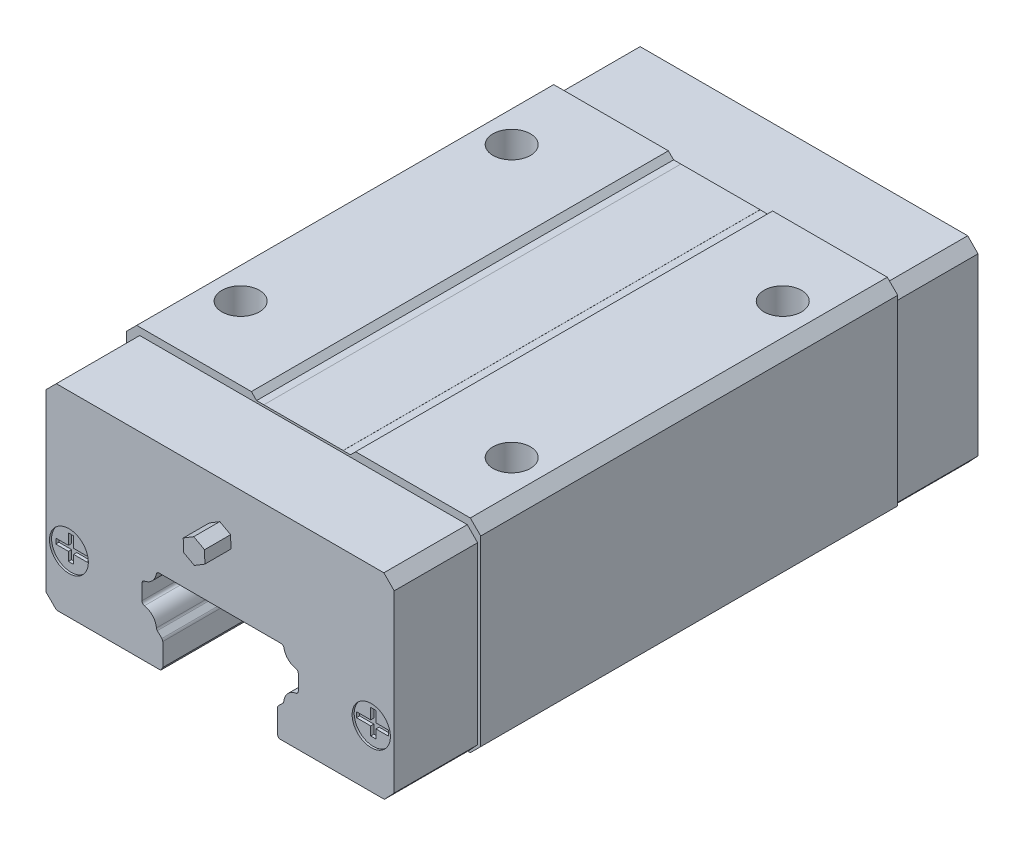
from build123d import *

# Parameters (mm, degrees)
SKETCH_1_R          = 0.735969578
EXTRUDE_1_DEPTH     = 40
SKETCH_2_R          = 0.735969578
EXTRUDE_2_DEPTH     = 8
SKETCH_3_R          = 1.863573056
SKETCH_3_R_2        = 1.835239234
CUT_EXTRUDE_3_DEPTH = 0.2
CUT_EXTRUDE_6_DEPTH = 0.5
EXTRUDE_7_DEPTH     = 2.5
SKETCH_6_R          = 1.8
CUT_EXTRUDE_8_DEPTH = 10


with BuildPart() as part:
    # 草图1 → 拉伸1 (new body)
    with BuildSketch(Plane.XY):
        with BuildLine():
            Line((1190.283750121, 451.89461201), (1190.783750121, 451.39461201))
            Line((1190.783750121, 451.39461201), (1191.483750121, 451.39461201))
            Line((1191.483750121, 451.39461201), (1199.081809381, 451.402434026))
            Line((1199.081809381, 451.402434026), (1199.083750121, 451.39461201))
            Line((1199.083750121, 451.39461201), (1199.783750121, 451.39461201))
            Line((1199.783750121, 451.39461201), (1200.283750121, 451.89461201))
            Line((1200.283750121, 451.89461201), (1211.283750121, 451.89461201))
            Line((1211.283750121, 451.89461201), (1212.283750121, 450.89461201))
            Line((1212.283750121, 450.89461201), (1212.283750121, 433.39461201))
            Line((1212.283750121, 433.39461201), (1211.283750121, 432.39461201))
            Line((1211.283750121, 432.39461201), (1200.983749521, 432.39461201))
            Line((1200.983749521, 432.39461201), (1200.871618065, 432.506743541))
            ThreePointArc((1200.871618065, 432.506743541), (1200.80658624, 432.604070545), (1200.783750099, 432.718875575))
            Line((1200.783750099, 432.718875575), (1200.783750099, 434.876567528))
            ThreePointArc((1200.783750099, 434.876567528), (1200.806586127, 434.991372287), (1200.87161765, 435.088699147))
            Line((1200.87161765, 435.088699147), (1201.302904227, 435.519987412))
            ThreePointArc((1201.302904227, 435.519987412), (1201.362083129, 435.604095006), (1201.389379239, 435.703247172))
            ThreePointArc((1201.389379239, 435.703247172), (1201.754733531, 436.527663779), (1202.540800569, 436.969529272))
            ThreePointArc((1202.540800569, 436.969529272), (1202.71512489, 437.073094794), (1202.783750031, 437.263896724))
            Line((1202.783750031, 437.263896724), (1202.783750031, 438.725177348))
            ThreePointArc((1202.783750031, 438.725177348), (1202.715175139, 438.916076324), (1202.540800569, 439.01970279))
            ThreePointArc((1202.540800569, 439.01970279), (1201.801578733, 439.4124447), (1201.408836823, 440.151666536))
            ThreePointArc((1201.408836823, 440.151666536), (1201.305210357, 440.326041106), (1201.114311381, 440.394615998))
            Line((1201.114311381, 440.394615998), (1189.453188747, 440.394615998))
            ThreePointArc((1189.453188747, 440.394615998), (1189.26228977, 440.326041106), (1189.158663305, 440.151666536))
            ThreePointArc((1189.158663305, 440.151666536), (1188.765921394, 439.412444701), (1188.026699559, 439.01970279))
            ThreePointArc((1188.026699559, 439.01970279), (1187.852375251, 438.916137249), (1187.783750121, 438.725335317))
            Line((1187.783750121, 438.725335317), (1187.783750121, 437.264054693))
            ThreePointArc((1187.783750121, 437.264054693), (1187.852325013, 437.073155717), (1188.026699583, 436.969529251))
            ThreePointArc((1188.026699583, 436.969529251), (1188.812766668, 436.527663733), (1189.178120982, 435.703247076))
            ThreePointArc((1189.178120982, 435.703247076), (1189.205417093, 435.60409491), (1189.264595994, 435.519987316))
            Line((1189.264595994, 435.519987316), (1189.695882571, 435.088699051))
            ThreePointArc((1189.695882571, 435.088699051), (1189.760914094, 434.991372191), (1189.783750121, 434.876567432))
            Line((1189.783750121, 434.876567432), (1189.783750121, 432.718875479))
            ThreePointArc((1189.783750121, 432.718875479), (1189.760913981, 432.604070449), (1189.695882156, 432.506743445))
            Line((1189.695882156, 432.506743445), (1189.583750721, 432.39461201))
            Line((1189.583750721, 432.39461201), (1179.583750121, 432.39461201))
            Line((1179.583750121, 432.39461201), (1178.583750121, 433.39461201))
            Line((1178.583750121, 433.39461201), (1178.583750121, 445.59461201))
            Line((1178.583750121, 445.59461201), (1178.283750121, 445.89461201))
            Line((1178.283750121, 445.89461201), (1178.283750121, 450.89461201))
            Line((1178.283750121, 450.89461201), (1179.283750121, 451.89461201))
            Line((1179.283750121, 451.89461201), (1190.283750121, 451.89461201))
        make_face()
        with Locations((1195.283750121, 446.39461201)):
            Circle(SKETCH_1_R, mode=Mode.SUBTRACT)
    extrude(amount=EXTRUDE_1_DEPTH)

    # 草图2 → 拉伸2 (add)
    with BuildSketch(Plane.XY.offset(40)):
        with BuildLine():
            Line((1211.041388892, 432.39461201), (1200.983749521, 432.39461201))
            ThreePointArc((1200.983749521, 432.39461201), (1200.8413936, 432.530619311), (1200.783750099, 432.718875575))
            Line((1200.783750099, 432.718875575), (1200.783750099, 434.876567528))
            ThreePointArc((1200.783750099, 434.876567528), (1200.806586127, 434.991372287), (1200.87161765, 435.088699147))
            Line((1200.87161765, 435.088699147), (1201.302904227, 435.519987412))
            ThreePointArc((1201.302904227, 435.519987412), (1201.362107996, 435.604083272), (1201.389379239, 435.703247172))
            ThreePointArc((1201.389379239, 435.703247172), (1201.754548351, 436.527832162), (1202.540800569, 436.969529272))
            ThreePointArc((1202.540800569, 436.969529272), (1202.715168649, 437.073058679), (1202.783750031, 437.263896724))
            Line((1202.783750031, 437.263896724), (1202.783750031, 438.725177348))
            ThreePointArc((1202.783750031, 438.725177348), (1202.715175139, 438.916076324), (1202.540800569, 439.01970279))
            ThreePointArc((1202.540800569, 439.01970279), (1201.801578746, 439.412444713), (1201.408836823, 440.151666536))
            ThreePointArc((1201.408836823, 440.151666536), (1201.305210357, 440.326041106), (1201.114311381, 440.394615998))
            Line((1201.114311381, 440.394615998), (1189.453188747, 440.394615998))
            ThreePointArc((1189.453188747, 440.394615998), (1189.26228977, 440.326041106), (1189.158663305, 440.151666536))
            ThreePointArc((1189.158663305, 440.151666536), (1188.765921381, 439.412444713), (1188.026699559, 439.01970279))
            ThreePointArc((1188.026699559, 439.01970279), (1187.852375251, 438.916137249), (1187.783750121, 438.725335317))
            Line((1187.783750121, 438.725335317), (1187.783750121, 437.264054693))
            ThreePointArc((1187.783750121, 437.264054693), (1187.852325013, 437.073155717), (1188.026699583, 436.969529251))
            ThreePointArc((1188.026699583, 436.969529251), (1188.812766654, 436.52766372), (1189.178120982, 435.703247076))
            ThreePointArc((1189.178120982, 435.703247076), (1189.205417092, 435.60409491), (1189.264595994, 435.519987316))
            Line((1189.264595994, 435.519987316), (1189.695882571, 435.088699051))
            ThreePointArc((1189.695882571, 435.088699051), (1189.760914094, 434.991372191), (1189.783750121, 434.876567432))
            Line((1189.783750121, 434.876567432), (1189.783750121, 432.718875479))
            Line((1189.783750121, 432.718875479), (1189.583750721, 432.39461201))
            Line((1189.583750721, 432.39461201), (1179.583750121, 432.39461201))
            Line((1179.583750121, 432.39461201), (1178.583750121, 433.39461201))
            Line((1178.583750121, 433.39461201), (1178.583750121, 450.204662517))
            Line((1178.583750121, 450.204662517), (1179.573699615, 451.19461201))
            Line((1179.573699615, 451.19461201), (1210.993800628, 451.19461201))
            Line((1210.993800628, 451.19461201), (1211.983750121, 450.188667467))
            Line((1211.983750121, 450.188667467), (1211.983750121, 433.39461201))
            Line((1211.983750121, 433.39461201), (1211.041388892, 432.39461201))
        make_face()
        with Locations((1195.283750121, 446.39461201)):
            Circle(SKETCH_2_R, mode=Mode.SUBTRACT)
    extrude_2 = extrude(amount=EXTRUDE_2_DEPTH)

    # 镜向2: 拉伸2 across plane
    add(extrude_2.mirror(Plane(origin=(0, 0, 20), x_dir=(1, 0, 0), z_dir=(0, 0, -1))))

    # 草图3 → 拉伸3 (cut)
    with BuildSketch(Plane.XY.offset(48)):
        with Locations((1180.782779751, 437.89461201)):
            Circle(SKETCH_3_R)
        with Locations((1209.782779751, 437.89461201)):
            Circle(SKETCH_3_R_2)
    cut_extrude_3 = extrude(amount=-CUT_EXTRUDE_3_DEPTH, mode=Mode.SUBTRACT)

    # 草图3<4> → 拉伸6 (cut)
    with BuildSketch(Plane.XY.offset(48)):
        Polygon((1209.532779751, 437.64461201), (1209.532779751, 436.80811406), (1210.032779751, 436.80811406), (1210.032779751, 436.829157907), (1210.032779751, 437.64461201), (1211.245181043, 437.64461201), (1211.245181043, 438.14461201), (1210.032779751, 438.14461201), (1210.032779751, 439.179594206), (1209.532779751, 439.179594206), (1209.532779751, 438.14461201), (1208.172931448, 438.14461201), (1208.172931448, 437.64461201), align=None)
        Polygon((1179.320378459, 438.14461201), (1180.532779751, 438.14461201), (1180.532779751, 439.179594206), (1181.032779751, 439.179594206), (1181.032779751, 438.14461201), (1182.392628054, 438.14461201), (1182.392628054, 437.64461201), (1181.032779751, 437.64461201), (1181.032779751, 436.80811406), (1180.532779751, 436.80811406), (1180.532779751, 437.64461201), (1179.320378459, 437.64461201), align=None)
    cut_extrude_6 = extrude(amount=-CUT_EXTRUDE_6_DEPTH, mode=Mode.SUBTRACT)

    # 镜向3: 拉伸3, 拉伸6 across plane
    add(cut_extrude_3.mirror(Plane(origin=(0, 0, 20), x_dir=(1, 0, 0), z_dir=(0, 0, -1))), mode=Mode.SUBTRACT)
    add(cut_extrude_6.mirror(Plane(origin=(0, 0, 20), x_dir=(1, 0, 0), z_dir=(0, 0, -1))), mode=Mode.SUBTRACT)

    # 草图5 → 拉伸7 (add)
    with BuildSketch(Plane.XY.offset(48)):
        Polygon((1196.321229408, 445.828909184), (1196.292402783, 447.010244015), (1195.254923496, 447.575946841), (1194.246270835, 446.960314836), (1194.27509746, 445.778980005), (1195.312576746, 445.213277179), align=None)
    extrude_7 = extrude(amount=EXTRUDE_7_DEPTH)

    # 镜向4: 拉伸7 across plane
    add(extrude_7.mirror(Plane(origin=(0, 0, 20), x_dir=(1, 0, 0), z_dir=(0, 0, -1))))

    # 草图6 → 拉伸8 (cut)
    with BuildSketch(Plane(origin=(0, 451.89461201, 0), x_dir=(1, 0, 0), z_dir=(0, 1, 0))):
        with Locations((1208.254923496, -7)):
            Circle(SKETCH_6_R)
        with Locations((1182.254923496, -7)):
            Circle(SKETCH_6_R)
        with Locations((1208.254923496, -33)):
            Circle(SKETCH_6_R)
        with Locations((1182.254923496, -33)):
            Circle(SKETCH_6_R)
    extrude(amount=-CUT_EXTRUDE_8_DEPTH, mode=Mode.SUBTRACT)


solid = part.part
